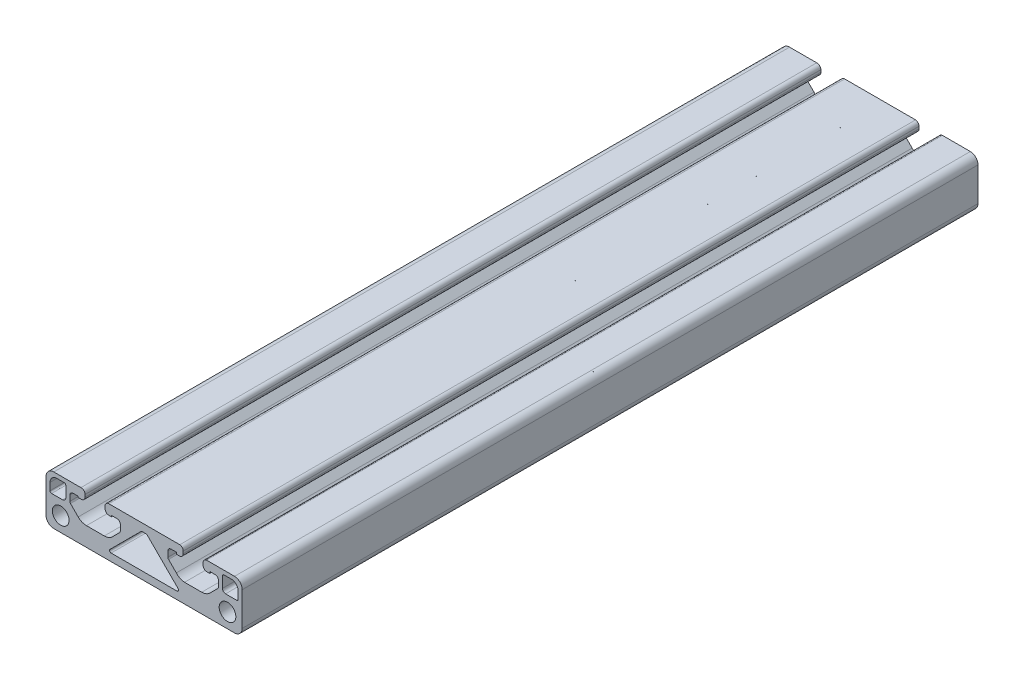
from build123d import *

# Parameters (mm, degrees)
SKETCH1_R      = 3.4
SKETCH1_R_2    = 3.400000006
EXTRUDE1_DEPTH = 300


with BuildPart() as part:
    # Sketch1 → Extrude1 (new body)
    with BuildSketch(Plane.XY):
        with BuildLine():
            Line((-36.828217803, 10), (-25.761678346, 10))
            ThreePointArc((-25.761678346, 10), (-24.566343162, 9.581217839), (-24.06, 8.420260776))
            Line((-24.06, 8.420260776), (-24.06, 7.505975062))
            ThreePointArc((-24.06, 7.505975062), (-24.567063435, 6.348506245), (-25.761678346, 5.936507937))
            Line((-25.761678346, 5.936507937), (-26.89856374, 5.936507937))
            Line((-26.89856374, 5.936507937), (-26.89856374, 6.405354551))
            Line((-26.89856374, 6.405354551), (-29.01515873, 6.405354551))
            ThreePointArc((-29.01515873, 6.405354551), (-29.913072103, 6.033426654), (-30.285, 5.135513281))
            Line((-30.285, 5.135513281), (-30.285, 2.878955078))
            ThreePointArc((-30.285, 2.878955078), (-30.217342047, 2.538803338), (-30.024667785, 2.250433031))
            Line((-30.024667785, 2.250433031), (-26.865511635, -0.908897163))
            ThreePointArc((-26.865511635, -0.908897163), (-25.324726136, -1.938463161), (-23.50722312, -2.3))
            Line((-23.50722312, -2.3), (-16.234679932, -2.3))
            ThreePointArc((-16.234679932, -2.3), (-14.417176915, -1.938463161), (-12.876391416, -0.908897163))
            Line((-12.876391416, -0.908897163), (-9.975332215, 1.992321863))
            ThreePointArc((-9.975332215, 1.992321863), (-9.782657953, 2.28069217), (-9.715, 2.620843911))
            Line((-9.715, 2.620843911), (-9.715, 5.135513281))
            ThreePointArc((-9.715, 5.135513281), (-10.086927897, 6.033426654), (-10.98484127, 6.405354551))
            Line((-10.98484127, 6.405354551), (-13.228511431, 6.405354551))
            Line((-13.228511431, 6.405354551), (-13.228511431, 5.936507937))
            Line((-13.228511431, 5.936507937), (-14.365396825, 5.936507937))
            ThreePointArc((-14.365396825, 5.936507937), (-15.478809408, 6.397698529), (-15.94, 7.511111111))
            Line((-15.94, 7.511111111), (-15.94, 8.425396825))
            ThreePointArc((-15.94, 8.425396825), (-15.478809408, 9.538809408), (-14.365396825, 10))
            Line((-14.365396825, 10), (-7.044126982, 10))
            Line((-7.044126982, 10), (14.552471996, 10))
            ThreePointArc((14.552471996, 10), (15.546813416, 9.477564883), (15.94, 8.425396825))
            Line((15.94, 8.425396825), (15.94, 7.511111111))
            ThreePointArc((15.94, 7.511111111), (15.478809408, 6.397698529), (14.365396825, 5.936507937))
            Line((14.365396825, 5.936507937), (13.228511431, 5.936507937))
            Line((13.228511431, 5.936507937), (13.228511431, 6.660633301))
            Line((13.228511431, 6.660633301), (10.98484127, 6.660633301))
            ThreePointArc((10.98484127, 6.660633301), (10.086927897, 6.288705404), (9.715, 5.390792031))
            Line((9.715, 5.390792031), (9.715, 3.134233829))
            ThreePointArc((9.715, 3.134233829), (9.782657953, 2.794082088), (9.975332215, 2.505711781))
            Line((9.975332215, 2.505711781), (13.134488365, -0.653618412))
            ThreePointArc((13.134488365, -0.653618412), (14.64473832, -1.821319739), (16.49277688, -2.3))
            Line((16.49277688, -2.3), (23.50722312, -2.3))
            ThreePointArc((23.50722312, -2.3), (25.324726136, -1.938463161), (26.865511635, -0.908897163))
            Line((26.865511635, -0.908897163), (30.024667785, 2.250433031))
            ThreePointArc((30.024667785, 2.250433031), (30.278278636, 2.655971567), (30.285, 3.134233829))
            Line((30.285, 3.134233829), (30.285, 5.390792031))
            ThreePointArc((30.285, 5.390792031), (29.913072103, 6.288705404), (29.01515873, 6.660633301))
            Line((29.01515873, 6.660633301), (26.771488569, 6.660633301))
            Line((26.771488569, 6.660633301), (26.771488569, 5.936507937))
            Line((26.771488569, 5.936507937), (25.634603175, 5.936507937))
            ThreePointArc((25.634603175, 5.936507937), (24.521190592, 6.397698529), (24.06, 7.511111111))
            Line((24.06, 7.511111111), (24.06, 8.425396825))
            ThreePointArc((24.06, 8.425396825), (24.453186584, 9.477564883), (25.447528004, 10))
            Line((25.447528004, 10), (33.075833554, 10))
            Line((33.075833554, 10), (36.885357363, 10))
            ThreePointArc((36.885357363, 10), (39.090491138, 9.050251023), (40, 6.828217785))
            Line((40, 6.828217785), (40, -6.828217785))
            ThreePointArc((40, -6.828217785), (39.069183486, -9.071177839), (36.825396825, -10))
            Line((36.825396825, -10), (-36.828217803, -10))
            ThreePointArc((-36.828217803, -10), (-39.071006503, -9.071006503), (-40, -6.828217803))
            Line((-40, -6.828217803), (-40, 6.828217803))
            ThreePointArc((-40, 6.828217803), (-39.071006503, 9.071006503), (-36.828217803, 10))
        make_face()
        with Locations((-34.004773868, -4)):
            Circle(SKETCH1_R, mode=Mode.SUBTRACT)
        with Locations(Location((34.004773868, -4, 0), (0, 0, 180))):
            Circle(SKETCH1_R_2, mode=Mode.SUBTRACT)
        with BuildLine():
            Line((-38.35, 2.595292927), (-38.35, 5.557055178))
            ThreePointArc((-38.35, 5.557055178), (-37.509428882, 7.554544736), (-35.493548116, 8.35))
            Line((-35.493548116, 8.35), (-32.569919859, 8.35))
            ThreePointArc((-32.569919859, 8.35), (-32.120963721, 8.164036279), (-31.935, 7.715080141))
            Line((-31.935, 7.715080141), (-31.935, 3.230213422))
            ThreePointArc((-31.935, 3.230213422), (-32.306927856, 2.332300148), (-33.20484113, 1.960372292))
            Line((-33.20484113, 1.960372292), (-37.715079365, 1.960372292))
            ThreePointArc((-37.715079365, 1.960372292), (-38.164036052, 2.14633624), (-38.35, 2.595292927))
        make_face(mode=Mode.SUBTRACT)
        with BuildLine():
            Line((13.450195503, -6.954394873), (-13.450195503, -6.954394873))
            ThreePointArc((-13.450195503, -6.954394873), (-14.036762187, -6.562412722), (-13.89908728, -5.870490687))
            Line((-13.89908728, -5.870490687), (-1.257767926, 6.769315833))
            ThreePointArc((-1.257767926, 6.769315833), (-1.051776589, 6.906937009), (-0.808800063, 6.955252915))
            Line((-0.808800063, 6.955252915), (0, 6.955204454))
            Line((0, 6.955204454), (0.808800063, 6.955252915))
            ThreePointArc((0.808800063, 6.955252915), (1.051776589, 6.906937009), (1.257767926, 6.769315833))
            Line((1.257767926, 6.769315833), (13.89908728, -5.870490687))
            ThreePointArc((13.89908728, -5.870490687), (14.036762187, -6.562412722), (13.450195503, -6.954394873))
        make_face(mode=Mode.SUBTRACT)
        with BuildLine():
            Line((35.554894965, 8.35), (32.563967874, 8.35))
            ThreePointArc((32.563967874, 8.35), (32.121226634, 8.164362109), (31.935, 7.721868186))
            Line((31.935, 7.721868186), (31.935, 3.245873842))
            ThreePointArc((31.935, 3.245873842), (32.306927897, 2.347960469), (33.20484127, 1.976032573))
            Line((33.20484127, 1.976032573), (37.680832198, 1.976032573))
            ThreePointArc((37.680832198, 1.976032573), (38.126707117, 2.122693703), (38.35, 2.535554718))
            Line((38.35, 2.535554718), (38.35, 5.496770698))
            ThreePointArc((38.35, 5.496770698), (37.552616332, 7.511327921), (35.554894965, 8.35))
        make_face(mode=Mode.SUBTRACT)
    extrude(amount=-EXTRUDE1_DEPTH)


solid = part.part
